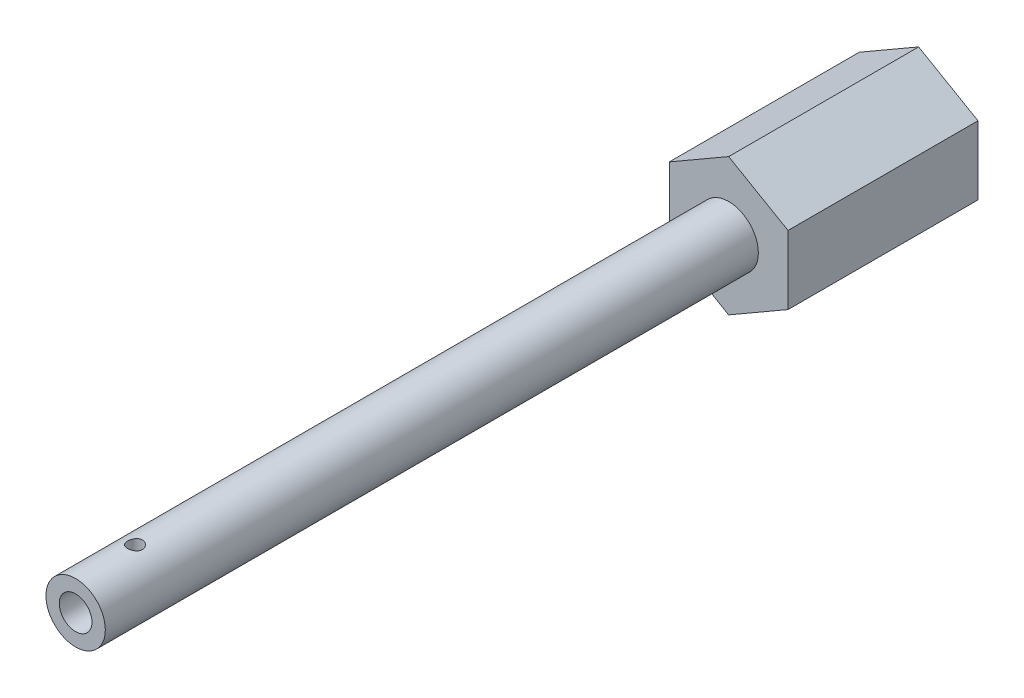
from build123d import *

# Parameters (mm, degrees)
BOSS_EXTRUDE1_DEPTH            = 20.32
SKETCH2_R                      = 3.175
BOSS_EXTRUDE2_DEPTH            = 69.85
F_3_5_3_5_DIAMETER_HOLE1_D     = 3.5
F_3_5_3_5_DIAMETER_HOLE1_DEPTH = 25.4
F_3_5_3_5_DIAMETER_HOLE1_TIP   = 1.051506083
F_1_16_0_0625_DIAMETER_HOLE1_D = 1.5875


with BuildPart() as part:
    # Sketch1 → Boss-Extrude1 (new body)
    with BuildSketch(Plane.XY):
        Polygon((0, 7.332348419), (-6.35, 3.666174209), (-6.35, -3.666174209), (0, -7.332348419), (6.35, -3.666174209), (6.35, 3.666174209), align=None)
    extrude(amount=BOSS_EXTRUDE1_DEPTH)

    # Sketch2 → Boss-Extrude2 (add)
    with BuildSketch(Plane.XY.offset(20.32)):
        Circle(SKETCH2_R)
    extrude(amount=BOSS_EXTRUDE2_DEPTH)

    # Ø3.5 (3.5) Diameter Hole1
    with Locations(Plane.XY.offset(90.17)):
        with Locations((0, 0)):
            Hole(F_3_5_3_5_DIAMETER_HOLE1_D / 2, depth=F_3_5_3_5_DIAMETER_HOLE1_DEPTH)
            with Locations((0, 0, -(F_3_5_3_5_DIAMETER_HOLE1_DEPTH + F_3_5_3_5_DIAMETER_HOLE1_TIP / 2))):  # 118° drill point
                Cone(0, F_3_5_3_5_DIAMETER_HOLE1_D / 2, F_3_5_3_5_DIAMETER_HOLE1_TIP, mode=Mode.SUBTRACT)

    # 1/16 (0.0625) Diameter Hole1 (through all)
    with Locations(Plane(origin=(0, 7.62, 0), x_dir=(1, 0, 0), z_dir=(0, 1, 0))):
        with Locations((0, -83.82)):
            Hole(F_1_16_0_0625_DIAMETER_HOLE1_D / 2)


solid = part.part
